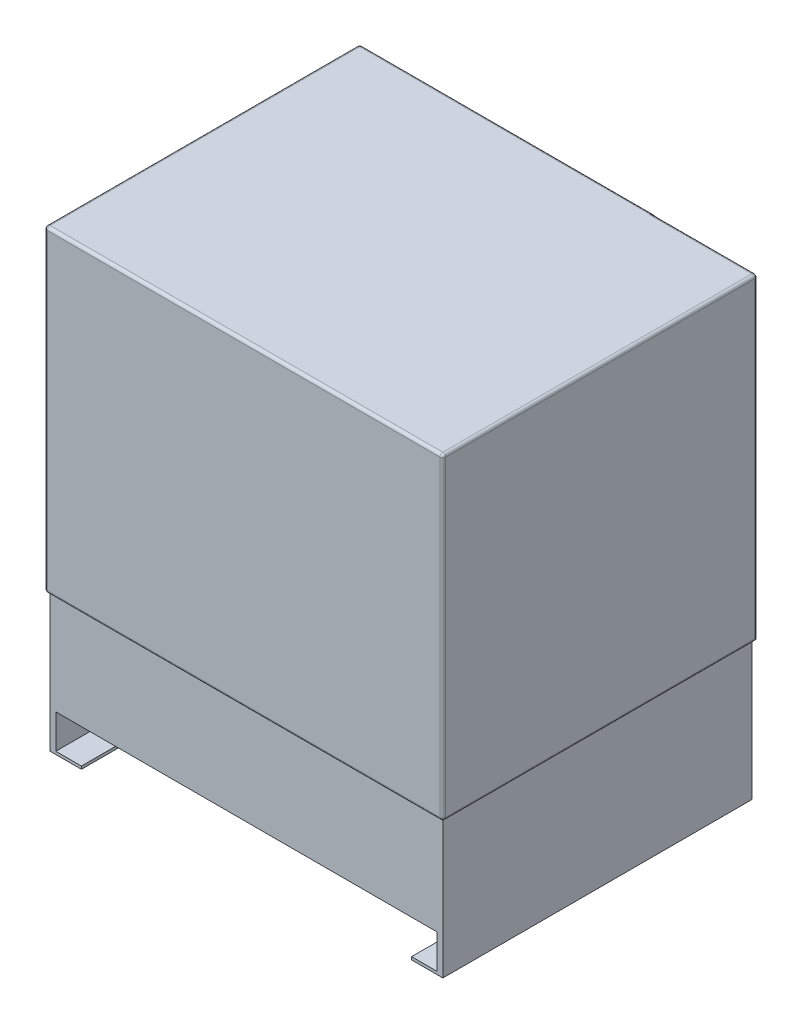
from build123d import *

# Parameters (mm, degrees)
SKETCH_1_W           = 700
SKETCH_1_H           = 800
EXTRUDE_1_DEPTH      = 277
CUT_EXTRUDE_1_DEPTH  = 768.734329049
SKETCH_3_W           = 700
SKETCH_3_H           = 2
CUT_EXTRUDE_2_DEPTH  = 768.734329049
SKETCH_4_W           = 700
SKETCH_4_H           = 240
CUT_EXTRUDE_3_DEPTH  = 5
SKETCH_6_W           = 700
SKETCH_6_H           = 240
CUT_EXTRUDE_5_DEPTH  = 5
SKETCH_7_W           = 544
SKETCH_7_H           = 240
CUT_EXTRUDE_6_DEPTH  = 5
SKETCH_8_W           = 544
SKETCH_8_H           = 240
CUT_EXTRUDE_7_DEPTH  = 5
SKETCH_9_W           = 670
SKETCH_9_H           = 60
EXTRUDE_2_DEPTH      = 5
SKETCH_11_W          = 180
SKETCH_11_H          = 800
CUT_EXTRUDE_8_DEPTH  = 1
SKETCH_12_W          = 175
SKETCH_12_H          = 240
CUT_EXTRUDE_9_DEPTH  = 1
FILLET_3_R           = 5
EXTRUDE_4_DEPTH      = 2
CUT_EXTRUDE_10_DEPTH = 765.134150526
EXTRUDE_5_DEPTH      = 2


with BuildPart() as part:
    # 草图1 → 凸台-拉伸1 (new, symmetric)
    with BuildSketch(Plane.XY):
        Rectangle(SKETCH_1_W, SKETCH_1_H)
    extrude(amount=EXTRUDE_1_DEPTH, both=True)

    # 草图2 → 切除-拉伸1 (cut, through all)
    with BuildSketch(Plane(origin=(0, 0, -277), x_dir=(-1, 0, 0), z_dir=(0, 0, -1))):
        Polygon((290, -395), (290, -400), (-290, -400), (-290, -395), (-335, -395), (-335, -335), (-280, -335), (280, -335), (335, -335), (335, -395), align=None)
    extrude(amount=-CUT_EXTRUDE_1_DEPTH, mode=Mode.SUBTRACT)

    # 草图3 → 切除-拉伸2 (cut, through all)
    with BuildSketch(Plane.XY.offset(277)):
        with Locations((0, -159)):
            Rectangle(SKETCH_3_W, SKETCH_3_H)
    extrude(amount=-CUT_EXTRUDE_2_DEPTH, mode=Mode.SUBTRACT)


with BuildPart() as cut_extrude_2_piece_1:
    # of the separate pieces the step leaves, piece 1, a body of its own (cut_extrude_2_pieces)
    add(part.part.solids().sort_by_distance((350, 400, -277))[0])

    # 草图11 → 切除-拉伸8 (cut)
    with BuildSketch(Plane(origin=(0, 0, -277), x_dir=(-1, 0, 0), z_dir=(0, 0, -1))):
        with Locations((-260, 0)):
            Rectangle(SKETCH_11_W, SKETCH_11_H)
    extrude(amount=-CUT_EXTRUDE_8_DEPTH, mode=Mode.SUBTRACT)

    # 圆角3
    fillet_3_edges = [cut_extrude_2_piece_1.edges().sort_by_distance(p)[0] for p in [
        (0, 400, 277),
        (-350, 121, 277),
        (350, 121, 277),
        (-350, -158, 0),
        (0, -158, 277),
        (-350, 121, -277),
        (350, -158, 0.5),
        (-90, 400, -277),
        (350, 121, -276),
        (170, 400, -276.5),
        (260, 400, -276),
        (-350, 400, 0),
        (350, 400, 0.5),
    ]]
    fillet(fillet_3_edges, radius=FILLET_3_R)

    # 草图14 → 凸台-拉伸4 (add)
    # profile 1 of 7: a face of its own
    with BuildSketch(Plane(origin=(0, 0, -277), x_dir=(-1, 0, 0), z_dir=(0, 0, -1))):
        Polygon((99.137157077, 355.412694136), (102.22008977, 355.412694136), (110.104705154, 342.522069136), (117.977301308, 355.412694136), (121.060234, 355.412694136), (111.444849385, 339.673511444), (111.444849385, 325.412694136), (108.752541693, 325.412694136), (108.752541693, 339.673511444), align=None)
    # profile 2 of 7: a face of its own
    with BuildSketch(Plane(origin=(0, 0, -277), x_dir=(-1, 0, 0), z_dir=(0, 0, -1))):
        Polygon((138.752541693, 355.412694136), (152.598695539, 325.412694136), (149.672012847, 325.412694136), (145.236916693, 335.028078751), (131.637157077, 335.028078751), (127.075859, 325.412694136), (124.137157077, 325.412694136), (138.367926308, 355.412694136), align=None)
        Polygon((138.530185923, 349.565338367), (133.097493616, 338.105001828), (143.818647462, 338.105001828), align=None, mode=Mode.SUBTRACT)
    # profile 3 of 7: a face of its own
    with BuildSketch(Plane(origin=(0, 0, -277), x_dir=(-1, 0, 0), z_dir=(0, 0, -1))):
        with BuildLine():
            Line((154.906387847, 331.199953751), (157.442445539, 332.720386444))
            add(Edge.make_bspline(
                [(157.442445539, 332.720386444), (157.678316144, 332.325548858), (158.130235121, 331.569055282), (158.884103913, 330.546843507), (159.665243152, 329.67802502), (160.47943744, 328.967654099), (161.321716995, 328.408377926), (162.197580313, 328.012358797), (163.104075833, 327.765364723), (163.720994303, 327.735363981), (164.028984, 327.720386444)],
                knots=[0, 0, 0, 0, 1.272034388, 2.437168799, 3.508375237, 4.49857839, 5.41946034, 6.295179144, 7.148887113, 8, 8, 8, 8], degree=3))
            add(Edge.make_bspline(
                [(164.028984, 327.720386444), (164.292014233, 327.727712208), (164.813472288, 327.742235553), (165.581148656, 327.881785285), (166.326706961, 328.096174961), (167.034780999, 328.403211517), (167.695600552, 328.774684252), (168.275086512, 329.223365773), (168.776053197, 329.72570468), (169.185845607, 330.286127434), (169.50024591, 330.88884585), (169.74189221, 331.507496862), (169.875992842, 332.151798876), (169.896193586, 332.585602843), (169.906387847, 332.804521059)],
                knots=[0, 0, 0, 0, 1.095163259, 2.171163733, 3.241058638, 4.321873601, 5.38011039, 6.391990106, 7.366004449, 8.327778327, 9.272591725, 10.192022065, 11.087607919, 12, 12, 12, 12], degree=3))
            add(Edge.make_bspline(
                [(169.906387847, 332.804521059), (169.893750898, 333.054299771), (169.868061827, 333.562063392), (169.650934855, 334.311203274), (169.309369882, 335.05256816), (168.994261508, 335.511150437), (168.830666693, 335.749232597)],
                knots=[0, 0, 0, 0, 0.938893495, 1.908633276, 2.914225137, 4, 4, 4, 4], degree=3))
            add(Edge.make_bspline(
                [(168.830666693, 335.749232597), (168.696347143, 335.921062514), (168.414360049, 336.28179793), (167.929581369, 336.818757092), (167.360728961, 337.372629254), (166.727269919, 337.964564028), (166.006129157, 338.567030857), (165.21989332, 339.208758953), (164.348488814, 339.865343899), (163.737350272, 340.305680175), (163.422012847, 340.532886444)],
                knots=[0, 0, 0, 0, 0.722233717, 1.516239348, 2.393582979, 3.351407094, 4.387010283, 5.505090956, 6.712668013, 8, 8, 8, 8], degree=3))
            add(Edge.make_bspline(
                [(163.422012847, 340.532886444), (163.106378594, 340.757702909), (162.502909937, 341.187534871), (161.658979231, 341.825457305), (160.904312406, 342.408690473), (160.242263692, 342.942724862), (159.673124291, 343.427632903), (159.192409339, 343.858758096), (158.812364564, 344.247760046), (158.601031016, 344.500114404), (158.506147462, 344.61341529)],
                knots=[0, 0, 0, 0, 1.452282411, 2.77665338, 3.964542531, 5.026858415, 5.96415736, 6.766646006, 7.446254459, 8, 8, 8, 8], degree=3))
            add(Edge.make_bspline(
                [(158.506147462, 344.61341529), (158.373525646, 344.789995606), (158.112707045, 345.137264495), (157.768426998, 345.68004899), (157.475805603, 346.235676979), (157.246414185, 346.805641533), (157.053246595, 347.381940923), (156.923321474, 347.972094458), (156.841966643, 348.573454045), (156.83363533, 348.978141193), (156.82946477, 349.180722982)],
                knots=[0, 0, 0, 0, 1.068054152, 2.10047183, 3.106115577, 4.101338837, 5.06977816, 6.043150881, 7.020423561, 8, 8, 8, 8], degree=3))
            add(Edge.make_bspline(
                [(156.82946477, 349.180722982), (156.840652275, 349.49812105), (156.862788161, 350.126133025), (157.049992595, 351.043540143), (157.345474541, 351.919423719), (157.759430723, 352.745112294), (158.293065176, 353.499106416), (158.910602099, 354.190079161), (159.646129124, 354.770952723), (160.453151609, 355.278484652), (161.336491941, 355.67573544), (162.262128256, 355.975400984), (163.231531731, 356.145194621), (163.888130027, 356.169561177), (164.221291693, 356.181924905)],
                knots=[0, 0, 0, 0, 1.005424448, 1.989358655, 2.955360095, 3.929531133, 4.905563448, 5.876582895, 6.856512386, 7.866279853, 8.892233794, 9.918561126, 10.94386622, 12, 12, 12, 12], degree=3))
            add(Edge.make_bspline(
                [(164.221291693, 356.181924905), (164.574812552, 356.169731606), (165.27785271, 356.145483025), (166.311988844, 355.934647042), (167.307652127, 355.585784141), (168.108594397, 355.189881358), (168.735446638, 354.794469224), (169.213498633, 354.434299301), (169.697933925, 354.019655513), (170.192660109, 353.549433404), (170.689294333, 353.019318395), (171.195209638, 352.432941061), (171.711589085, 351.793884868), (172.043782172, 351.337674862), (172.214080154, 351.103799905)],
                knots=[0, 0, 0, 0, 1.286793592, 2.559021753, 3.825965368, 5.121522368, 5.803751409, 6.523245864, 7.299691795, 8.125521123, 9.008227632, 9.944561021, 10.946284179, 12, 12, 12, 12], degree=3))
            Line((172.214080154, 351.103799905), (169.780185923, 349.258847982))
            add(Edge.make_bspline(
                [(169.780185923, 349.258847982), (169.633220788, 349.448179614), (169.350200299, 349.81278807), (168.920518983, 350.323399347), (168.515530572, 350.789826314), (168.116527145, 351.194955983), (167.744581733, 351.560974269), (167.383578514, 351.874343613), (167.038712646, 352.138134431), (166.603996269, 352.419650659), (166.057844397, 352.698706404), (165.372262658, 352.934841359), (164.655808872, 353.07674189), (164.167840602, 353.095503783), (163.920810923, 353.105001828)],
                knots=[0, 0, 0, 0, 1.181633172, 2.275549214, 3.290209073, 4.226197932, 5.078386478, 5.862611352, 6.581680152, 7.217281963, 8.414376989, 9.595101626, 10.782541182, 12, 12, 12, 12], degree=3))
            add(Edge.make_bspline(
                [(163.920810923, 353.105001828), (163.610897874, 353.094615829), (163.013259754, 353.074587407), (162.164772015, 352.855844676), (161.401109801, 352.51142873), (160.744944957, 352.028728918), (160.198628011, 351.456834695), (159.803438365, 350.798730223), (159.565579811, 350.072023915), (159.536554557, 349.565095432), (159.521772462, 349.306924905)],
                knots=[0, 0, 0, 0, 1.14458467, 2.207223713, 3.21896685, 4.227309161, 5.202851033, 6.127160689, 7.046193047, 8, 8, 8, 8], degree=3))
            add(Edge.make_bspline(
                [(159.521772462, 349.306924905), (159.525142119, 349.146197946), (159.531886943, 348.824481208), (159.625956637, 348.349183306), (159.746808028, 347.875086111), (159.9383163, 347.404321115), (160.202704617, 346.92865518), (160.549891839, 346.43989743), (160.987148799, 345.933739927), (161.32209462, 345.604533866), (161.498935923, 345.430722982)],
                knots=[0, 0, 0, 0, 0.858281714, 1.717966888, 2.583508476, 3.4729293, 4.427298488, 5.488583878, 6.674047936, 8, 8, 8, 8], degree=3))
            add(Edge.make_bspline(
                [(161.498935923, 345.430722982), (161.56460483, 345.372119904), (161.72061912, 345.232892404), (162.00584134, 345.00495857), (162.382493896, 344.72379195), (162.840741335, 344.375900666), (163.389033007, 343.972345276), (164.027429203, 343.518285743), (164.74881377, 342.998981809), (165.260715906, 342.635917175), (165.531387847, 342.443944136)],
                knots=[0, 0, 0, 0, 0.420754252, 0.999615792, 1.744751191, 2.668019286, 3.750313428, 4.999500688, 6.413464383, 8, 8, 8, 8], degree=3))
            add(Edge.make_bspline(
                [(165.531387847, 342.443944136), (165.856981389, 342.207018197), (166.487448158, 341.748243953), (167.384513129, 341.058966696), (168.197888627, 340.384842965), (168.930430372, 339.730177762), (169.589375301, 339.099936964), (170.167412907, 338.486538276), (170.670433024, 337.894376224), (171.211969182, 337.135182718), (171.765321921, 336.202773425), (172.240534842, 335.060388523), (172.54017782, 333.913562919), (172.579362238, 333.142761463), (172.598695539, 332.762453751)],
                knots=[0, 0, 0, 0, 1.163667725, 2.253281268, 3.268753668, 4.215851969, 5.092017293, 5.902905408, 6.650798638, 7.335211899, 8.59617414, 9.77448103, 10.901945474, 12, 12, 12, 12], degree=3))
            add(Edge.make_bspline(
                [(172.598695539, 332.762453751), (172.593062926, 332.493496336), (172.581907083, 331.960804477), (172.453670679, 331.178618104), (172.265787835, 330.418924935), (171.982611544, 329.6911154), (171.636984473, 328.981874577), (171.198416634, 328.309806859), (170.690065051, 327.660037728), (170.106918494, 327.049893517), (169.46881076, 326.489783266), (168.794379092, 325.991534167), (168.082519609, 325.576091395), (167.337094038, 325.237084178), (166.557931152, 324.971939742), (165.745293005, 324.779829435), (164.897840051, 324.661923341), (164.321835924, 324.649685386), (164.028984, 324.643463367)],
                knots=[0, 0, 0, 0, 0.983748083, 1.948392443, 2.894712957, 3.844097841, 4.80183111, 5.778335162, 6.776009319, 7.81870978, 8.863265674, 9.881300176, 10.883814829, 11.87499822, 12.874611388, 13.892143829, 14.928324115, 16, 16, 16, 16], degree=3))
            add(Edge.make_bspline(
                [(164.028984, 324.643463367), (163.802395346, 324.647844923), (163.352071689, 324.656552855), (162.685990415, 324.733535259), (162.033365365, 324.84245329), (161.402385805, 325.015373889), (160.784922277, 325.22517655), (160.183660266, 325.483505115), (159.598308376, 325.793081127), (159.025586237, 326.147038481), (158.466950455, 326.558962006), (157.92764073, 327.038734833), (157.389961997, 327.573124875), (156.869784314, 328.17664399), (156.356585934, 328.839541843), (155.860485281, 329.568020558), (155.371213415, 330.358112161), (155.064223691, 330.91409861), (154.906387847, 331.199953751)],
                knots=[0, 0, 0, 0, 0.915332311, 1.819136955, 2.706846663, 3.586547465, 4.459518054, 5.340707479, 6.227863349, 7.133153174, 8.059268498, 9.028702269, 10.047606654, 11.120612155, 12.245963614, 13.433783089, 14.680604001, 16, 16, 16, 16], degree=3))
        make_face()
    # profile 4 of 7: a face of its own
    with BuildSketch(Plane(origin=(0, 0, -277), x_dir=(-1, 0, 0), z_dir=(0, 0, -1))):
        Polygon((178.752541693, 355.412694136), (181.444849385, 355.412694136), (181.444849385, 343.98841529), (193.950859, 355.412694136), (197.791003231, 355.412694136), (183.049416693, 341.951155674), (198.944849385, 325.412694136), (195.357109, 325.412694136), (181.444849385, 339.889857597), (181.444849385, 325.412694136), (178.752541693, 325.412694136), align=None)
    # profile 5 of 7: a face of its own
    with BuildSketch(Plane(origin=(0, 0, -277), x_dir=(-1, 0, 0), z_dir=(0, 0, -1))):
        Polygon((215.675618616, 355.412694136), (229.521772462, 325.412694136), (226.59508977, 325.412694136), (222.159993616, 335.028078751), (208.560234, 335.028078751), (203.998935923, 325.412694136), (201.060234, 325.412694136), (215.291003231, 355.412694136), align=None)
        Polygon((215.453262847, 349.565338367), (210.020570539, 338.105001828), (220.741724385, 338.105001828), align=None, mode=Mode.SUBTRACT)
    # profile 6 of 7: a face of its own
    with BuildSketch(Plane(origin=(0, 0, -277), x_dir=(-1, 0, 0), z_dir=(0, 0, -1))):
        Polygon((232.983310923, 355.412694136), (235.765762847, 355.412694136), (241.637157077, 333.411492213), (250.369128231, 355.412694136), (250.759753231, 355.412694136), (259.32946477, 333.561732597), (265.230907077, 355.412694136), (267.983310923, 355.412694136), (259.894368616, 325.412694136), (259.509753231, 325.412694136), (250.483310923, 348.357405674), (241.348695539, 325.412694136), (240.964080154, 325.412694136), align=None)
    # profile 7 of 7: a face of its own
    with BuildSketch(Plane(origin=(0, 0, -277), x_dir=(-1, 0, 0), z_dir=(0, 0, -1))):
        Polygon((285.675618616, 355.412694136), (299.521772462, 325.412694136), (296.59508977, 325.412694136), (292.159993616, 335.028078751), (278.560234, 335.028078751), (273.998935923, 325.412694136), (271.060234, 325.412694136), (285.291003231, 355.412694136), align=None)
        Polygon((285.453262847, 349.565338367), (280.020570539, 338.105001828), (290.741724385, 338.105001828), align=None, mode=Mode.SUBTRACT)
    extrude(amount=EXTRUDE_4_DEPTH)

    # 草图13 → 凸台-拉伸5 (add)
    # profile 1 of 5: a face of its own
    with BuildSketch(Plane(origin=(0, 0, -276), x_dir=(-1, 0, 0), z_dir=(0, 0, -1))):
        with BuildLine():
            add(Edge.make_bspline(
                [(-210.307667809, 77.128666568), (-210.788502562, 77.131478152), (-211.722530998, 77.136939695), (-213.083542215, 77.197697589), (-214.360344694, 77.298629093), (-215.55299954, 77.436949437), (-216.661814685, 77.605274963), (-217.683826819, 77.829979199), (-218.623766538, 78.085517289), (-219.484697596, 78.381681843), (-220.278223474, 78.715860368), (-221.019001358, 79.079591502), (-221.705966089, 79.487258185), (-222.349883167, 79.915744534), (-222.940918163, 80.381731471), (-223.485880921, 80.875227351), (-223.980175665, 81.406102159), (-224.424140891, 81.969206895), (-224.813433613, 82.560725134), (-225.158447732, 83.164492902), (-225.442634026, 83.79129818), (-225.675106237, 84.43288943), (-225.864878667, 85.090618884), (-225.995232884, 85.764318631), (-226.077105703, 86.455550356), (-226.084943085, 86.922102776), (-226.088917809, 87.158714645)],
                knots=[0, 0, 0, 0, 1.646148282, 3.197666765, 4.66315463, 6.030252048, 7.307778049, 8.501004361, 9.610818041, 10.641065266, 11.615491391, 12.557119604, 13.464013759, 14.348536654, 15.203310953, 16.038349431, 16.863300206, 17.683791446, 18.490318933, 19.285717724, 20.06220424, 20.843281102, 21.620494212, 22.403315558, 23.190242141, 24, 24, 24, 24], degree=3))
            add(Edge.make_bspline(
                [(-226.088917809, 87.158714645), (-226.085607096, 87.397420168), (-226.079019942, 87.872360146), (-225.986301781, 88.572004274), (-225.866627767, 89.259461795), (-225.674690356, 89.92430262), (-225.445012353, 90.579097612), (-225.141955876, 91.207563332), (-224.812358423, 91.831887944), (-224.410277256, 92.423709218), (-223.965911399, 93.000709691), (-223.461442548, 93.541587391), (-222.910831933, 94.060168597), (-222.301799329, 94.536866702), (-221.643683011, 94.992112322), (-220.930966067, 95.408623875), (-220.165227978, 95.79506404), (-219.350018594, 96.158696868), (-218.463562407, 96.476684173), (-217.511388476, 96.759400307), (-216.484874409, 96.991134016), (-215.389738543, 97.182773718), (-214.220555584, 97.331522608), (-212.979694437, 97.439779535), (-211.666378798, 97.49698391), (-210.768454095, 97.507754718), (-210.307667809, 97.513281953)],
                knots=[0, 0, 0, 0, 0.810910589, 1.61342667, 2.396193133, 3.181089899, 3.963115317, 4.752255436, 5.550715454, 6.36105385, 7.181178335, 8.024612154, 8.872680183, 9.750181803, 10.651284446, 11.591556747, 12.554036451, 13.566402641, 14.62422919, 15.753422176, 16.94128843, 18.199818041, 19.531985927, 20.947085226, 22.433341622, 24, 24, 24, 24], degree=3))
            add(Edge.make_bspline(
                [(-210.307667809, 97.513281953), (-209.848895473, 97.507633116), (-208.952995331, 97.49660195), (-207.645527378, 97.441006409), (-206.411354742, 97.328878391), (-205.249161609, 97.190666498), (-204.158409138, 96.996884857), (-203.139808069, 96.763394003), (-202.189752088, 96.4973659), (-201.31504822, 96.174498345), (-200.501253471, 95.819329365), (-199.741145804, 95.433303881), (-199.028617082, 95.019142769), (-198.368764878, 94.570724777), (-197.762176831, 94.086185474), (-197.209677721, 93.567967747), (-196.702000235, 93.02236755), (-196.252738785, 92.442003267), (-195.847596373, 91.84466954), (-195.506038016, 91.220281499), (-195.210097737, 90.584818913), (-194.968139263, 89.931937295), (-194.78049764, 89.262644656), (-194.651504244, 88.574715947), (-194.560831793, 87.872261414), (-194.553926754, 87.397387143), (-194.550456271, 87.158714645)],
                knots=[0, 0, 0, 0, 1.561645053, 3.049612875, 4.452756685, 5.778837748, 7.032101753, 8.221335837, 9.334924186, 10.387562255, 11.392109817, 12.355697819, 13.287721948, 14.19548756, 15.068665045, 15.927346723, 16.771751757, 17.602390507, 18.423119567, 19.225778204, 20.022010933, 20.807278863, 21.593079439, 22.384715467, 23.188155646, 24, 24, 24, 24], degree=3))
            add(Edge.make_bspline(
                [(-194.550456271, 87.158714645), (-194.554453604, 86.922107954), (-194.562335563, 86.455565742), (-194.643881832, 85.764259236), (-194.77498615, 85.093266871), (-194.958557024, 84.439277523), (-195.18325569, 83.798936068), (-195.476001289, 83.180967511), (-195.813151437, 82.57850311), (-196.197108436, 81.993141354), (-196.637022927, 81.435915507), (-197.123519303, 80.903560798), (-197.669072977, 80.409943223), (-198.265094786, 79.947996812), (-198.909969899, 79.514980592), (-199.604131085, 79.110836688), (-200.348763636, 78.739477834), (-201.14856082, 78.399589928), (-202.015602376, 78.098241376), (-202.957938084, 77.833084074), (-203.985139275, 77.62131108), (-205.091990638, 77.44180073), (-206.280741212, 77.297956735), (-207.551821073, 77.197739502), (-208.902816544, 77.136985821), (-209.830838677, 77.131490256), (-210.307667809, 77.128666568)],
                knots=[0, 0, 0, 0, 0.810927267, 1.598990287, 2.382942141, 3.152806972, 3.926217614, 4.706701772, 5.493896336, 6.292070767, 7.104102563, 7.925577746, 8.761822141, 9.623241997, 10.509042271, 11.423174113, 12.375371989, 13.360203808, 14.400680605, 15.520553799, 16.714061498, 17.994519714, 19.364400916, 20.818312473, 22.365209998, 24, 24, 24, 24], degree=3))
        make_face()
        with BuildLine():
            add(Edge.make_bspline(
                [(-210.31968704, 79.82097426), (-209.91898551, 79.822020542), (-209.141302521, 79.824051171), (-208.013192602, 79.875564664), (-206.959236605, 79.947266193), (-205.979845879, 80.037470842), (-205.078443365, 80.172565133), (-204.251281606, 80.325837864), (-203.499891664, 80.509679151), (-202.817707281, 80.728268949), (-202.19506845, 80.977264002), (-201.615379644, 81.248645517), (-201.071770467, 81.542769836), (-200.565559796, 81.865665865), (-200.102935498, 82.223717487), (-199.672171106, 82.600325385), (-199.288248225, 83.012455537), (-198.827715973, 83.582462271), (-198.351845403, 84.335015445), (-197.937448017, 85.283187163), (-197.677027546, 86.257489077), (-197.643909561, 86.918785387), (-197.627379348, 87.248858876)],
                knots=[0, 0, 0, 0, 1.459098681, 2.831824031, 4.11146945, 5.306290378, 6.412266529, 7.42953815, 8.369053297, 9.227277979, 10.03601793, 10.809473603, 11.557037441, 12.285528272, 12.993193355, 13.685654407, 14.36688038, 15.041354379, 16.352855396, 17.594313975, 18.799247529, 20, 20, 20, 20], degree=3))
            add(Edge.make_bspline(
                [(-197.627379348, 87.248858876), (-197.641853525, 87.580843032), (-197.670750535, 88.243633726), (-197.922952251, 89.217040647), (-198.332952151, 90.15421053), (-198.801367319, 90.893815067), (-199.2503104, 91.454931632), (-199.632636229, 91.85711073), (-200.060853126, 92.2262047), (-200.522840491, 92.576282212), (-201.027463621, 92.897359284), (-201.572285173, 93.18932924), (-202.158821129, 93.455757876), (-202.568276015, 93.607549707), (-202.777619733, 93.685156953)],
                knots=[0, 0, 0, 0, 1.353621445, 2.702441307, 4.075953605, 5.516772412, 6.261413105, 7.007624062, 7.778524365, 8.566925914, 9.372323995, 10.217594641, 11.088702136, 12, 12, 12, 12], degree=3))
            add(Edge.make_bspline(
                [(-202.777619733, 93.685156953), (-203.045303214, 93.775600677), (-203.588815479, 93.959240224), (-204.431932496, 94.195912575), (-205.316527616, 94.382301711), (-206.237314331, 94.549987703), (-207.201083196, 94.664442468), (-208.204852201, 94.756566581), (-209.249378164, 94.810829612), (-209.959049517, 94.81755605), (-210.31968704, 94.82097426)],
                knots=[0, 0, 0, 0, 0.884706709, 1.796334032, 2.740027952, 3.714592787, 4.726048262, 5.777819803, 6.87074269, 8, 8, 8, 8], degree=3))
            add(Edge.make_bspline(
                [(-210.31968704, 94.82097426), (-210.680266233, 94.816258353), (-211.385636217, 94.807033029), (-212.418649194, 94.771770277), (-213.399801432, 94.680711069), (-214.333319763, 94.579575758), (-215.214036664, 94.43045674), (-216.049324925, 94.26967547), (-216.828836809, 94.053665315), (-217.564775237, 93.822923567), (-218.24878377, 93.558837304), (-218.884034698, 93.268121196), (-219.473653367, 92.957683297), (-220.015818016, 92.620344151), (-220.513673446, 92.260802557), (-220.95576403, 91.866167374), (-221.363595043, 91.461500858), (-221.820803722, 90.885979771), (-222.290661113, 90.138648128), (-222.711290159, 89.202300491), (-222.960229777, 88.233221051), (-222.994752189, 87.576743014), (-223.011994733, 87.248858876)],
                knots=[0, 0, 0, 0, 1.313483664, 2.569454835, 3.763100662, 4.901599063, 5.988328865, 7.015709358, 7.99797933, 8.932480776, 9.824041341, 10.666387587, 11.475829342, 12.24921787, 12.990555181, 13.709176526, 14.405678811, 15.080244297, 16.38186033, 17.610124501, 18.806354173, 20, 20, 20, 20], degree=3))
            add(Edge.make_bspline(
                [(-223.011994733, 87.248858876), (-222.994709291, 86.917003397), (-222.960106918, 86.252687879), (-222.712441428, 85.273259576), (-222.291891792, 84.330586346), (-221.821708956, 83.580790278), (-221.365348029, 83.012260806), (-220.976932335, 82.608818958), (-220.556456554, 82.226988023), (-220.089728252, 81.878208107), (-219.585301217, 81.557226757), (-219.048721854, 81.251735585), (-218.467949907, 80.983983155), (-217.845799306, 80.734188717), (-217.163577401, 80.515234316), (-216.409468671, 80.33349362), (-215.580331592, 80.168040207), (-214.672342915, 80.048886782), (-213.692743159, 79.943964277), (-212.636091851, 79.876351817), (-211.504108103, 79.823815186), (-210.722401508, 79.821940202), (-210.31968704, 79.82097426)],
                knots=[0, 0, 0, 0, 1.207546505, 2.417292871, 3.651582144, 4.952510111, 5.626719005, 6.30238548, 6.989136872, 7.692112372, 8.420316868, 9.164734959, 9.937886623, 10.746308695, 11.604196049, 12.543341915, 13.568754172, 14.680483261, 15.875568977, 17.154711427, 18.534182925, 20, 20, 20, 20], degree=3))
        make_face(mode=Mode.SUBTRACT)
    # profile 2 of 5: a face of its own
    with BuildSketch(Plane(origin=(0, 0, -276), x_dir=(-1, 0, 0), z_dir=(0, 0, -1))):
        with BuildLine():
            add(Edge.make_bspline(
                [(-210.307667809, 24.974820414), (-210.788502562, 24.977631998), (-211.722530998, 24.983093541), (-213.083542215, 25.043851435), (-214.360344694, 25.144782939), (-215.55299954, 25.283103284), (-216.661814685, 25.451428809), (-217.683826819, 25.676133045), (-218.623766538, 25.931671135), (-219.484697596, 26.227835689), (-220.278223474, 26.562014214), (-221.019001358, 26.925745348), (-221.705966089, 27.333412031), (-222.349883167, 27.76189838), (-222.940918163, 28.227885318), (-223.485880921, 28.721381197), (-223.980175665, 29.252256005), (-224.424140891, 29.815360741), (-224.813433613, 30.40687898), (-225.158447732, 31.010646749), (-225.442634026, 31.637452026), (-225.675106237, 32.279043277), (-225.864878667, 32.936772731), (-225.995232884, 33.610472478), (-226.077105703, 34.301704202), (-226.084943085, 34.768256623), (-226.088917809, 35.004868491)],
                knots=[0, 0, 0, 0, 1.646148282, 3.197666765, 4.66315463, 6.030252048, 7.307778049, 8.501004361, 9.610818041, 10.641065266, 11.615491391, 12.557119604, 13.464013759, 14.348536654, 15.203310953, 16.038349431, 16.863300206, 17.683791446, 18.490318933, 19.285717724, 20.06220424, 20.843281102, 21.620494212, 22.403315558, 23.190242141, 24, 24, 24, 24], degree=3))
            add(Edge.make_bspline(
                [(-226.088917809, 35.004868491), (-226.085607096, 35.243574014), (-226.079019942, 35.718513992), (-225.986301781, 36.41815812), (-225.866627767, 37.105615641), (-225.674690356, 37.770456466), (-225.445012353, 38.425251458), (-225.141955876, 39.053717178), (-224.812358423, 39.67804179), (-224.410277256, 40.269863064), (-223.965911399, 40.846863537), (-223.461442548, 41.387741237), (-222.910831933, 41.906322443), (-222.301799329, 42.383020548), (-221.643683011, 42.838266168), (-220.930966067, 43.254777721), (-220.165227978, 43.641217886), (-219.350018594, 44.004850714), (-218.463562407, 44.322838019), (-217.511388476, 44.605554154), (-216.484874409, 44.837287862), (-215.389738543, 45.028927564), (-214.220555584, 45.177676454), (-212.979694437, 45.285933381), (-211.666378798, 45.343137757), (-210.768454095, 45.353908564), (-210.307667809, 45.359435799)],
                knots=[0, 0, 0, 0, 0.810910589, 1.61342667, 2.396193133, 3.181089899, 3.963115317, 4.752255436, 5.550715454, 6.36105385, 7.181178335, 8.024612154, 8.872680183, 9.750181803, 10.651284446, 11.591556747, 12.554036451, 13.566402641, 14.62422919, 15.753422176, 16.94128843, 18.199818041, 19.531985927, 20.947085226, 22.433341622, 24, 24, 24, 24], degree=3))
            add(Edge.make_bspline(
                [(-210.307667809, 45.359435799), (-209.848895473, 45.353786962), (-208.952995331, 45.342755796), (-207.645527378, 45.287160255), (-206.411354742, 45.175032237), (-205.249161609, 45.036820344), (-204.158409138, 44.843038703), (-203.139808069, 44.609547849), (-202.189752088, 44.343519746), (-201.31504822, 44.020652191), (-200.501253471, 43.665483211), (-199.741145804, 43.279457727), (-199.028617082, 42.865296615), (-198.368764878, 42.416878623), (-197.762176831, 41.93233932), (-197.209677721, 41.414121593), (-196.702000235, 40.868521396), (-196.252738785, 40.288157113), (-195.847596373, 39.690823386), (-195.506038016, 39.066435345), (-195.210097737, 38.430972759), (-194.968139263, 37.778091141), (-194.78049764, 37.108798502), (-194.651504244, 36.420869793), (-194.560831793, 35.71841526), (-194.553926754, 35.243540989), (-194.550456271, 35.004868491)],
                knots=[0, 0, 0, 0, 1.561645053, 3.049612875, 4.452756685, 5.778837748, 7.032101753, 8.221335837, 9.334924186, 10.387562255, 11.392109817, 12.355697819, 13.287721948, 14.19548756, 15.068665045, 15.927346723, 16.771751757, 17.602390507, 18.423119567, 19.225778204, 20.022010933, 20.807278863, 21.593079439, 22.384715467, 23.188155646, 24, 24, 24, 24], degree=3))
            add(Edge.make_bspline(
                [(-194.550456271, 35.004868491), (-194.554453604, 34.7682618), (-194.562335563, 34.301719588), (-194.643881832, 33.610413082), (-194.77498615, 32.939420717), (-194.958557024, 32.28543137), (-195.18325569, 31.645089914), (-195.476001289, 31.027121357), (-195.813151437, 30.424656956), (-196.197108436, 29.8392952), (-196.637022927, 29.282069353), (-197.123519303, 28.749714645), (-197.669072977, 28.25609707), (-198.265094786, 27.794150658), (-198.909969899, 27.361134438), (-199.604131085, 26.956990534), (-200.348763636, 26.58563168), (-201.14856082, 26.245743774), (-202.015602376, 25.944395222), (-202.957938084, 25.67923792), (-203.985139275, 25.467464926), (-205.091990638, 25.287954576), (-206.280741212, 25.144110581), (-207.551821073, 25.043893348), (-208.902816544, 24.983139667), (-209.830838677, 24.977644102), (-210.307667809, 24.974820414)],
                knots=[0, 0, 0, 0, 0.810927267, 1.598990287, 2.382942141, 3.152806972, 3.926217614, 4.706701772, 5.493896336, 6.292070767, 7.104102563, 7.925577746, 8.761822141, 9.623241997, 10.509042271, 11.423174113, 12.375371989, 13.360203808, 14.400680605, 15.520553799, 16.714061498, 17.994519714, 19.364400916, 20.818312473, 22.365209998, 24, 24, 24, 24], degree=3))
        make_face()
        with BuildLine():
            add(Edge.make_bspline(
                [(-210.31968704, 27.667128106), (-209.91898551, 27.668174389), (-209.141302521, 27.670205017), (-208.013192602, 27.72171851), (-206.959236605, 27.793420039), (-205.979845879, 27.883624689), (-205.078443365, 28.018718979), (-204.251281606, 28.17199171), (-203.499891664, 28.355832998), (-202.817707281, 28.574422795), (-202.19506845, 28.823417848), (-201.615379644, 29.094799363), (-201.071770467, 29.388923682), (-200.565559796, 29.711819711), (-200.102935498, 30.069871334), (-199.672171106, 30.446479231), (-199.288248225, 30.858609383), (-198.827715973, 31.428616117), (-198.351845403, 32.181169291), (-197.937448017, 33.129341009), (-197.677027546, 34.103642923), (-197.643909561, 34.764939233), (-197.627379348, 35.095012722)],
                knots=[0, 0, 0, 0, 1.459098681, 2.831824031, 4.11146945, 5.306290378, 6.412266529, 7.42953815, 8.369053297, 9.227277979, 10.03601793, 10.809473603, 11.557037441, 12.285528272, 12.993193355, 13.685654407, 14.36688038, 15.041354379, 16.352855396, 17.594313975, 18.799247529, 20, 20, 20, 20], degree=3))
            add(Edge.make_bspline(
                [(-197.627379348, 35.095012722), (-197.641853525, 35.426996878), (-197.670750535, 36.089787572), (-197.922952251, 37.063194493), (-198.332952151, 38.000364376), (-198.801367319, 38.739968913), (-199.2503104, 39.301085478), (-199.632636229, 39.703264576), (-200.060853126, 40.072358546), (-200.522840491, 40.422436058), (-201.027463621, 40.74351313), (-201.572285173, 41.035483086), (-202.158821129, 41.301911723), (-202.568276015, 41.453703553), (-202.777619733, 41.531310799)],
                knots=[0, 0, 0, 0, 1.353621445, 2.702441307, 4.075953605, 5.516772412, 6.261413105, 7.007624062, 7.778524365, 8.566925914, 9.372323995, 10.217594641, 11.088702136, 12, 12, 12, 12], degree=3))
            add(Edge.make_bspline(
                [(-202.777619733, 41.531310799), (-203.045303214, 41.621754523), (-203.588815479, 41.80539407), (-204.431932496, 42.042066421), (-205.316527616, 42.228455557), (-206.237314331, 42.396141549), (-207.201083196, 42.510596314), (-208.204852201, 42.602720428), (-209.249378164, 42.656983458), (-209.959049517, 42.663709896), (-210.31968704, 42.667128106)],
                knots=[0, 0, 0, 0, 0.884706709, 1.796334032, 2.740027952, 3.714592787, 4.726048262, 5.777819803, 6.87074269, 8, 8, 8, 8], degree=3))
            add(Edge.make_bspline(
                [(-210.31968704, 42.667128106), (-210.680266233, 42.662412199), (-211.385636217, 42.653186875), (-212.418649194, 42.617924123), (-213.399801432, 42.526864915), (-214.333319763, 42.425729604), (-215.214036664, 42.276610586), (-216.049324925, 42.115829316), (-216.828836809, 41.899819161), (-217.564775237, 41.669077414), (-218.24878377, 41.40499115), (-218.884034698, 41.114275042), (-219.473653367, 40.803837143), (-220.015818016, 40.466497998), (-220.513673446, 40.106956403), (-220.95576403, 39.71232122), (-221.363595043, 39.307654704), (-221.820803722, 38.732133617), (-222.290661113, 37.984801974), (-222.711290159, 37.048454337), (-222.960229777, 36.079374898), (-222.994752189, 35.42289686), (-223.011994733, 35.095012722)],
                knots=[0, 0, 0, 0, 1.313483664, 2.569454835, 3.763100662, 4.901599063, 5.988328865, 7.015709358, 7.99797933, 8.932480776, 9.824041341, 10.666387587, 11.475829342, 12.24921787, 12.990555181, 13.709176526, 14.405678811, 15.080244297, 16.38186033, 17.610124501, 18.806354173, 20, 20, 20, 20], degree=3))
            add(Edge.make_bspline(
                [(-223.011994733, 35.095012722), (-222.994709291, 34.763157243), (-222.960106918, 34.098841725), (-222.712441428, 33.119413422), (-222.291891792, 32.176740192), (-221.821708956, 31.426944124), (-221.365348029, 30.858414652), (-220.976932335, 30.454972804), (-220.556456554, 30.07314187), (-220.089728252, 29.724361953), (-219.585301217, 29.403380604), (-219.048721854, 29.097889431), (-218.467949907, 28.830137001), (-217.845799306, 28.580342563), (-217.163577401, 28.361388162), (-216.409468671, 28.179647466), (-215.580331592, 28.014194053), (-214.672342915, 27.895040628), (-213.692743159, 27.790118123), (-212.636091851, 27.722505664), (-211.504108103, 27.669969032), (-210.722401508, 27.668094048), (-210.31968704, 27.667128106)],
                knots=[0, 0, 0, 0, 1.207546505, 2.417292871, 3.651582144, 4.952510111, 5.626719005, 6.30238548, 6.989136872, 7.692112372, 8.420316868, 9.164734959, 9.937886623, 10.746308695, 11.604196049, 12.543341915, 13.568754172, 14.680483261, 15.875568977, 17.154711427, 18.534182925, 20, 20, 20, 20], degree=3))
        make_face(mode=Mode.SUBTRACT)
    # profile 3 of 5: a face of its own
    with BuildSketch(Plane(origin=(0, 0, -276), x_dir=(-1, 0, 0), z_dir=(0, 0, -1))):
        with BuildLine():
            Line((-216.088917809, -23.332871894), (-216.088917809, -26.025179586))
            add(Edge.make_bspline(
                [(-216.088917809, -26.025179586), (-216.446096848, -26.00763256), (-217.147586972, -25.973170668), (-218.170363313, -25.811785332), (-219.147975873, -25.580863527), (-220.072575136, -25.25436535), (-220.952336341, -24.848882969), (-221.783765047, -24.362625592), (-222.563689522, -23.786678302), (-223.284879607, -23.133477724), (-223.946487357, -22.424032246), (-224.517818009, -21.658552765), (-225.000540907, -20.854166817), (-225.404094408, -20.013314826), (-225.707007373, -19.126509995), (-225.931764284, -18.201799785), (-226.066990104, -17.235121473), (-226.08152541, -16.576492713), (-226.088917809, -16.24152574)],
                knots=[0, 0, 0, 0, 1.10065271, 2.161652631, 3.183658789, 4.190468796, 5.17591951, 6.163126047, 7.15150782, 8.156236427, 9.156009102, 10.134482811, 11.092018607, 12.041330605, 13.001268258, 13.972401359, 14.968799086, 16, 16, 16, 16], degree=3))
            add(Edge.make_bspline(
                [(-226.088917809, -16.24152574), (-226.081279249, -15.912547669), (-226.06626975, -15.266117512), (-225.935433987, -14.323056307), (-225.734939843, -13.423149743), (-225.437839104, -12.576596453), (-225.065042666, -11.77470842), (-224.601421453, -11.02741435), (-224.068912461, -10.316643893), (-223.440791992, -9.677280424), (-222.770585865, -9.089947946), (-222.054811357, -8.583702861), (-221.314678476, -8.14772061), (-220.544405708, -7.790882757), (-219.74148467, -7.520383794), (-218.91361324, -7.319969987), (-218.051237222, -7.205402625), (-217.467449953, -7.187916038), (-217.170648579, -7.17902574)],
                knots=[0, 0, 0, 0, 1.111674182, 2.184400057, 3.212814286, 4.223731311, 5.211378316, 6.196328225, 7.191884489, 8.207283132, 9.220262353, 10.201199469, 11.166417575, 12.120932471, 13.06540007, 14.026332106, 14.996573967, 16, 16, 16, 16], degree=3))
            add(Edge.make_bspline(
                [(-217.170648579, -7.17902574), (-216.752810177, -7.193539649), (-215.924465845, -7.22231277), (-214.707192956, -7.468432655), (-213.527830828, -7.852844046), (-212.578621602, -8.315637516), (-211.813835493, -8.782635985), (-211.183837501, -9.203048497), (-210.505677545, -9.69800985), (-209.776610782, -10.263291312), (-209.006184956, -10.908627831), (-208.17868131, -11.617253652), (-207.309400957, -12.40746928), (-206.715283965, -12.96160041), (-206.407427425, -13.248737278)],
                knots=[0, 0, 0, 0, 1.184416499, 2.348048165, 3.509039915, 4.696071444, 5.333504901, 6.05069495, 6.844171097, 7.714965912, 8.667477798, 9.695072654, 10.805644396, 12, 12, 12, 12], degree=3))
            Line((-206.407427425, -13.248737278), (-198.396610117, -20.754746894))
            Line((-198.396610117, -20.754746894), (-198.396610117, -6.794410355))
            Line((-198.396610117, -6.794410355), (-195.31968704, -6.794410355))
            Line((-195.31968704, -6.794410355), (-195.31968704, -27.17902574))
            Line((-195.31968704, -27.17902574), (-207.735552425, -15.544410355))
            add(Edge.make_bspline(
                [(-207.735552425, -15.544410355), (-208.031252195, -15.261142754), (-208.599230938, -14.717043664), (-209.42845631, -13.94747872), (-210.197738088, -13.256287392), (-210.905622789, -12.638995454), (-211.562464799, -12.108993979), (-212.146990829, -11.638660563), (-212.684886118, -11.26181264), (-213.308377094, -10.852823534), (-214.069625527, -10.456703693), (-214.999914292, -10.11631207), (-215.957576458, -9.908756226), (-216.604736776, -9.883857636), (-216.930263963, -9.871333432)],
                knots=[0, 0, 0, 0, 1.329631726, 2.553950428, 3.673215718, 4.687767853, 5.603093632, 6.413772471, 7.123043292, 7.734684054, 8.834405432, 9.900288307, 10.943827018, 12, 12, 12, 12], degree=3))
            add(Edge.make_bspline(
                [(-216.930263963, -9.871333432), (-217.134961664, -9.876782652), (-217.538381524, -9.887522017), (-218.129859459, -9.982302282), (-218.700415006, -10.125535191), (-219.25180317, -10.33078026), (-219.778480187, -10.601695175), (-220.28108716, -10.931467003), (-220.766992576, -11.311953261), (-221.222592274, -11.752106998), (-221.63985975, -12.23563431), (-222.009494767, -12.746442164), (-222.318401431, -13.286871629), (-222.571631407, -13.854644105), (-222.770277532, -14.4481767), (-222.907922498, -15.068617372), (-222.994343789, -15.714251798), (-223.006036691, -16.155110332), (-223.011994733, -16.379746894)],
                knots=[0, 0, 0, 0, 0.991446411, 1.95395049, 2.89581595, 3.838931463, 4.798493298, 5.75982156, 6.748411868, 7.785213223, 8.824556874, 9.840280684, 10.836137867, 11.835679398, 12.848801643, 13.863922112, 14.911575587, 16, 16, 16, 16], degree=3))
            add(Edge.make_bspline(
                [(-223.011994733, -16.379746894), (-223.006107719, -16.614412916), (-222.994546597, -17.075258238), (-222.906976892, -17.750445013), (-222.774221178, -18.398991358), (-222.563376131, -19.011220383), (-222.314252228, -19.60038952), (-221.997767157, -20.153920939), (-221.630004473, -20.681004957), (-221.203568643, -21.172972062), (-220.724437162, -21.622294606), (-220.196401194, -22.022634499), (-219.623262178, -22.370129479), (-219.007372386, -22.673739064), (-218.342599852, -22.920187808), (-217.631455427, -23.108537209), (-216.87698439, -23.257565051), (-216.355969665, -23.307352689), (-216.088917809, -23.332871894)],
                knots=[0, 0, 0, 0, 1.030878251, 2.024474673, 2.987898669, 3.934362936, 4.864849709, 5.795128259, 6.730474222, 7.685293701, 8.650606017, 9.611896181, 10.591709709, 11.591680886, 12.625074257, 13.701333388, 14.821793024, 16, 16, 16, 16], degree=3))
        make_face()
    # profile 4 of 5: a face of its own
    with BuildSketch(Plane(origin=(0, 0, -276), x_dir=(-1, 0, 0), z_dir=(0, 0, -1))):
        Polygon((-225.31968704, -78.755948817), (-225.31968704, -75.648977663), (-213.048052425, -67.794410355), (-225.31968704, -59.939843047), (-225.31968704, -56.832871894), (-210.620167809, -66.237919971), (-195.31968704, -56.448256509), (-195.31968704, -59.555227663), (-208.192283194, -67.794410355), (-195.31968704, -76.033593047), (-195.31968704, -79.140564201), (-210.620167809, -69.344891124), align=None)
    # profile 5 of 5: a face of its own
    with BuildSketch(Plane(origin=(0, 0, -276), x_dir=(-1, 0, 0), z_dir=(0, 0, -1))):
        with BuildLine():
            Line((-195.31968704, -128.794410355), (-225.31968704, -128.794410355))
            Line((-225.31968704, -128.794410355), (-225.31968704, -122.736718047))
            add(Edge.make_bspline(
                [(-225.31968704, -122.736718047), (-225.315893583, -122.209841006), (-225.308564644, -121.191917303), (-225.262095577, -119.720953468), (-225.179891584, -118.359949789), (-225.060152788, -117.113382426), (-224.913126786, -115.97782918), (-224.728837606, -114.956469682), (-224.511224717, -114.044022743), (-224.325692286, -113.482856109), (-224.237956271, -113.217487278)],
                knots=[0, 0, 0, 0, 1.314313732, 2.53924729, 3.670748893, 4.714932338, 5.66265055, 6.526160246, 7.303039223, 8, 8, 8, 8], degree=3))
            add(Edge.make_bspline(
                [(-224.237956271, -113.217487278), (-224.105734269, -112.870358253), (-223.84428862, -112.183971936), (-223.350350955, -111.207221833), (-222.792996817, -110.284587322), (-222.15939994, -109.423424465), (-221.457834036, -108.621572507), (-220.693311082, -107.869930668), (-219.848847531, -107.187030687), (-218.939474333, -106.562236392), (-217.976843119, -105.998751221), (-216.96253043, -105.508996915), (-215.901757556, -105.102245709), (-214.797455412, -104.764590219), (-213.647200987, -104.498477522), (-212.449653497, -104.316918164), (-211.209546177, -104.197166806), (-210.368050771, -104.185132083), (-209.941081271, -104.17902574)],
                knots=[0, 0, 0, 0, 0.984741985, 1.947153288, 2.898543998, 3.841229145, 4.778974371, 5.722123648, 6.681464302, 7.655713756, 8.646344578, 9.637374342, 10.639946623, 11.656849581, 12.698333139, 13.76849723, 14.867749466, 16, 16, 16, 16], degree=3))
            add(Edge.make_bspline(
                [(-209.941081271, -104.17902574), (-209.570270659, -104.184416894), (-208.839549617, -104.195040726), (-207.762627607, -104.290434802), (-206.717654315, -104.429089192), (-205.709604815, -104.643752953), (-204.729650993, -104.904348801), (-203.788223211, -105.238316701), (-202.876736171, -105.620945303), (-202.007328319, -106.066945038), (-201.184175064, -106.557244497), (-200.40762447, -107.08013416), (-199.694908455, -107.647472761), (-199.027350627, -108.242468796), (-198.422784041, -108.87947051), (-197.870188261, -109.550722501), (-197.378814938, -110.258833434), (-196.940942615, -111.008186716), (-196.54936551, -111.808790151), (-196.222743225, -112.685826769), (-195.939854981, -113.635142224), (-195.714817368, -114.662150222), (-195.533322921, -115.763187738), (-195.412483218, -116.94130908), (-195.330531073, -118.194287756), (-195.323371904, -119.054684432), (-195.31968704, -119.497535355)],
                knots=[0, 0, 0, 0, 1.106010661, 2.179509527, 3.223302912, 4.248870533, 5.252098245, 6.246278179, 7.226402005, 8.199283979, 9.158616973, 10.083547221, 10.989831858, 11.874256832, 12.749262829, 13.607058236, 14.46581075, 15.317568432, 16.194266721, 17.121067875, 18.106207572, 19.147242834, 20.255495536, 21.43354536, 22.679031616, 24, 24, 24, 24], degree=3))
            Line((-195.31968704, -119.497535355), (-195.31968704, -128.794410355))
        make_face()
        with BuildLine():
            Line((-198.396610117, -126.102102663), (-198.396610117, -122.658593047))
            add(Edge.make_bspline(
                [(-198.396610117, -122.658593047), (-198.398736658, -122.163778441), (-198.402826773, -121.21206874), (-198.438717086, -119.843571621), (-198.497362265, -118.593176794), (-198.57943436, -117.460706713), (-198.68802249, -116.446800791), (-198.809093085, -115.549340078), (-198.959928377, -114.771266435), (-199.096650887, -114.30044269), (-199.159831271, -114.082871894)],
                knots=[0, 0, 0, 0, 1.375205317, 2.645023457, 3.804390687, 4.853969522, 5.800190428, 6.637939096, 7.370582563, 8, 8, 8, 8], degree=3))
            add(Edge.make_bspline(
                [(-199.159831271, -114.082871894), (-199.256273181, -113.809028762), (-199.446853487, -113.267883235), (-199.794490843, -112.488902916), (-200.206279054, -111.762412788), (-200.664016337, -111.075760976), (-201.183826124, -110.43865465), (-201.754483747, -109.843668564), (-202.378596401, -109.291531156), (-203.055152065, -108.790746837), (-203.776814305, -108.337151495), (-204.544859438, -107.947758922), (-205.348489907, -107.608649002), (-206.194211559, -107.340135358), (-207.075825703, -107.128424115), (-207.99790389, -106.980026367), (-208.959630182, -106.887898804), (-209.61434847, -106.876915428), (-209.947090886, -106.871333432)],
                knots=[0, 0, 0, 0, 0.998590647, 1.973329978, 2.929871262, 3.868367705, 4.809062953, 5.754642869, 6.701828697, 7.672172887, 8.647399344, 9.630604387, 10.631475358, 11.644913558, 12.679592956, 13.747988925, 14.855477812, 16, 16, 16, 16], degree=3))
            add(Edge.make_bspline(
                [(-209.947090886, -106.871333432), (-210.297949289, -106.875733038), (-210.987213726, -106.884376103), (-211.998562543, -106.993013049), (-212.971253833, -107.151769239), (-213.905352651, -107.381343691), (-214.802681384, -107.673894081), (-215.658277186, -108.038991011), (-216.481176062, -108.456133461), (-217.252384911, -108.952447777), (-217.981754418, -109.496010006), (-218.649939408, -110.099248972), (-219.258461982, -110.752580731), (-219.816798948, -111.44887944), (-220.302487598, -112.207768862), (-220.736944865, -113.011371926), (-221.105652505, -113.871477679), (-221.301757043, -114.469872215), (-221.401417809, -114.773977663)],
                knots=[0, 0, 0, 0, 1.122418816, 2.205001699, 3.251619955, 4.274784885, 5.280384055, 6.268708349, 7.249350384, 8.229342522, 9.199999885, 10.157847722, 11.105861043, 12.055065948, 13.010012805, 13.98527497, 14.976112212, 16, 16, 16, 16], degree=3))
            add(Edge.make_bspline(
                [(-221.401417809, -114.773977663), (-221.470987191, -115.025558917), (-221.618910785, -115.560489691), (-221.780271121, -116.433399383), (-221.922595398, -117.415814949), (-222.043092878, -118.512098102), (-222.129555632, -119.72099918), (-222.194452615, -121.043447934), (-222.23822375, -122.480015973), (-222.241212669, -123.475866263), (-222.242763963, -123.992727663)],
                knots=[0, 0, 0, 0, 0.674548936, 1.434276114, 2.292660221, 3.240891867, 4.284742987, 5.42552168, 6.663806718, 8, 8, 8, 8], degree=3))
            Line((-222.242763963, -123.992727663), (-222.242763963, -126.102102663))
            Line((-222.242763963, -126.102102663), (-198.396610117, -126.102102663))
        make_face(mode=Mode.SUBTRACT)
    extrude(amount=EXTRUDE_5_DEPTH)


with BuildPart() as cut_extrude_2_piece_2:
    # of the separate pieces the step leaves, piece 2, a body of its own (cut_extrude_2_pieces)
    add(part.part.solids().sort_by_distance((350, -400, -277))[0])

    # 草图4 → 切除-拉伸3 (cut)
    with BuildSketch(Plane(origin=(0, 0, -277), x_dir=(-1, 0, 0), z_dir=(0, 0, -1))):
        with Locations((0, -280)):
            Rectangle(SKETCH_4_W, SKETCH_4_H)
    extrude(amount=-CUT_EXTRUDE_3_DEPTH, mode=Mode.SUBTRACT)

    # 草图6 → 切除-拉伸5 (cut)
    with BuildSketch(Plane.XY.offset(277)):
        with Locations((0, -280)):
            Rectangle(SKETCH_6_W, SKETCH_6_H)
    extrude(amount=-CUT_EXTRUDE_5_DEPTH, mode=Mode.SUBTRACT)

    # 草图7 → 切除-拉伸6 (cut)
    with BuildSketch(Plane.ZY.offset(350)):
        with Locations((0, -280)):
            Rectangle(SKETCH_7_W, SKETCH_7_H)
    extrude(amount=-CUT_EXTRUDE_6_DEPTH, mode=Mode.SUBTRACT)

    # 草图8 → 切除-拉伸7 (cut)
    with BuildSketch(Plane(origin=(350, 0, 0), x_dir=(0, 0, -1), z_dir=(1, 0, 0))):
        with Locations((0, -280)):
            Rectangle(SKETCH_8_W, SKETCH_8_H)
    extrude(amount=-CUT_EXTRUDE_7_DEPTH, mode=Mode.SUBTRACT)

    # 草图9 → 凸台-拉伸2 (add)
    with BuildSketch(Plane(origin=(0, 0, -272), x_dir=(-1, 0, 0), z_dir=(0, 0, -1))):
        with Locations((0, -365)):
            Rectangle(SKETCH_9_W, SKETCH_9_H)
    extrude(amount=-EXTRUDE_2_DEPTH)

    # 草图12 → 切除-拉伸9 (cut)
    with BuildSketch(Plane(origin=(0, 0, -272), x_dir=(-1, 0, 0), z_dir=(0, 0, -1))):
        with Locations((-257.5, -280)):
            Rectangle(SKETCH_12_W, SKETCH_12_H)
    extrude(amount=-CUT_EXTRUDE_9_DEPTH, mode=Mode.SUBTRACT)

    # 草图15 → 切除-拉伸10 (cut, through all)
    with BuildSketch(Plane(origin=(0, 0, -272), x_dir=(-1, 0, 0), z_dir=(0, 0, -1))):
        Polygon((290, -400), (290, -395), (335, -395), (335, -335), (-335, -335), (-335, -395), (-290, -395), (-290, -400), align=None)
    extrude(amount=-CUT_EXTRUDE_10_DEPTH, mode=Mode.SUBTRACT)


solid = Compound([cut_extrude_2_piece_1.part, cut_extrude_2_piece_2.part])
